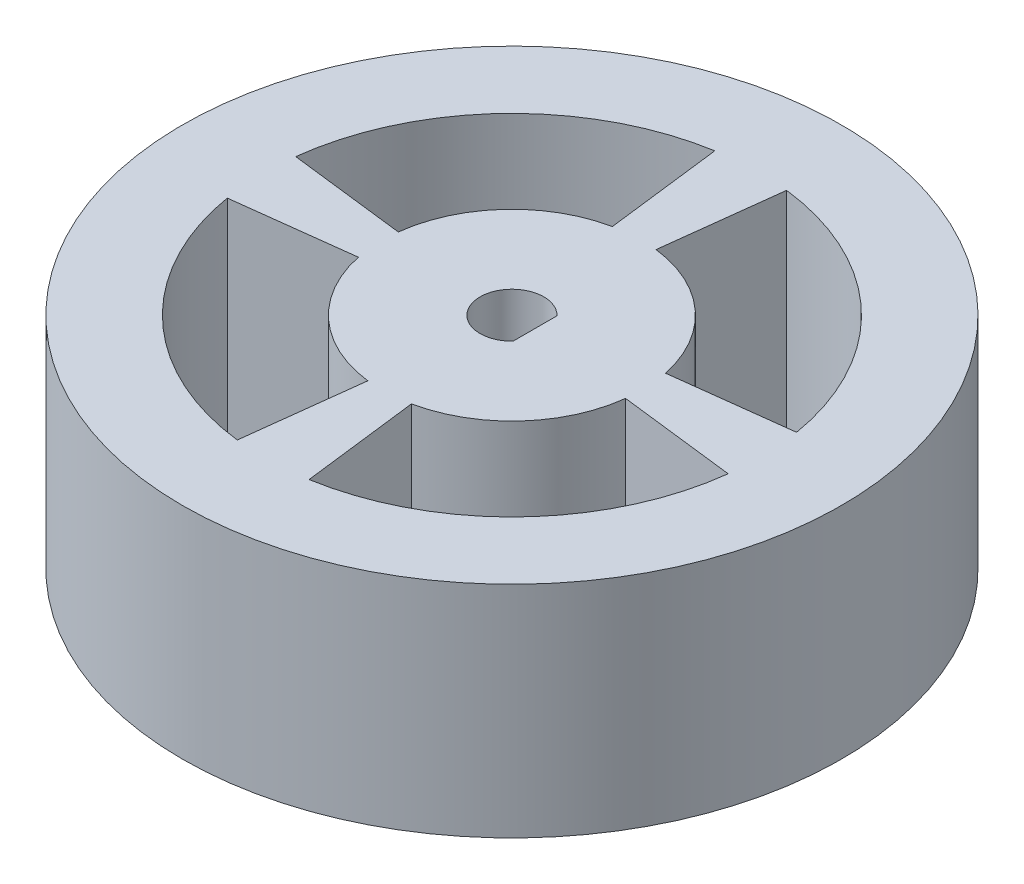
from build123d import *

# Parameters (mm, degrees)
ESBO_O1_R                = 15
RESSALTO_EXTRUS_O1_DEPTH = 10


with BuildPart() as part:
    # Esboço1 → Ressalto-extrusão1 (new body)
    with BuildSketch(Plane(origin=(0, 0, 0), x_dir=(1, 0, 0), z_dir=(0, 1, 0))):
        with Locations(Location((0, 0, 0), (0, 0, 270))):
            Circle(ESBO_O1_R)
        with BuildLine():
            Line((1.05, -1), (1.05, 1))
            ThreePointArc((1.05, 1), (-1.45, 0), (1.05, -1))
        make_face(mode=Mode.SUBTRACT)
        with BuildLine():
            Line((1.20846299, -5.78116293), (1.861701017, -11.094889334))
            ThreePointArc((1.861701017, -11.094889334), (8.142596912, -7.762771124), (11.171107828, -1.329981166))
            Line((11.171107828, -1.329981166), (5.865248184, -0.693607497))
            ThreePointArc((5.865248184, -0.693607497), (4.356621686, -3.987740601), (1.20846299, -5.78116293))
        make_face(mode=Mode.SUBTRACT)
        with BuildLine():
            Line((-5.78116293, -1.20846299), (-11.094889334, -1.861701017))
            ThreePointArc((-11.094889334, -1.861701017), (-7.762771124, -8.142596912), (-1.329981166, -11.171107828))
            Line((-1.329981166, -11.171107828), (-0.693607497, -5.865248184))
            ThreePointArc((-0.693607497, -5.865248184), (-3.987740601, -4.356621686), (-5.78116293, -1.20846299))
        make_face(mode=Mode.SUBTRACT)
        with BuildLine():
            Line((-1.20846299, 5.78116293), (-1.861701017, 11.094889334))
            ThreePointArc((-1.861701017, 11.094889334), (-8.142596912, 7.762771124), (-11.171107828, 1.329981166))
            Line((-11.171107828, 1.329981166), (-5.865248184, 0.693607497))
            ThreePointArc((-5.865248184, 0.693607497), (-4.356621686, 3.987740601), (-1.20846299, 5.78116293))
        make_face(mode=Mode.SUBTRACT)
        with BuildLine():
            Line((5.78116293, 1.20846299), (11.094889334, 1.861701017))
            ThreePointArc((11.094889334, 1.861701017), (7.762771124, 8.142596912), (1.329981166, 11.171107828))
            Line((1.329981166, 11.171107828), (0.693607497, 5.865248184))
            ThreePointArc((0.693607497, 5.865248184), (3.987740601, 4.356621686), (5.78116293, 1.20846299))
        make_face(mode=Mode.SUBTRACT)
    extrude(amount=RESSALTO_EXTRUS_O1_DEPTH)


solid = part.part
